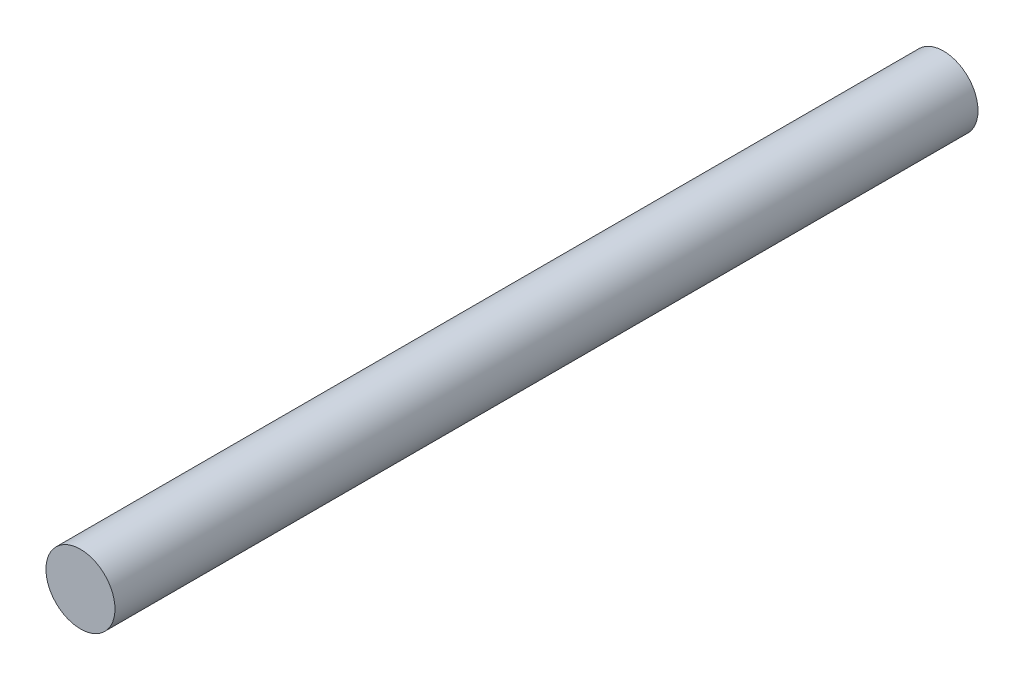
from build123d import *

# Parameters (mm, degrees)
SKETCH_1_R      = 2.6
EXTRUDE_4_DEPTH = 65


with BuildPart() as part:
    # 草图1 → 凸台-拉伸4 (new body)
    with BuildSketch(Plane.XY):
        Circle(SKETCH_1_R)
    extrude(amount=EXTRUDE_4_DEPTH)


solid = part.part
